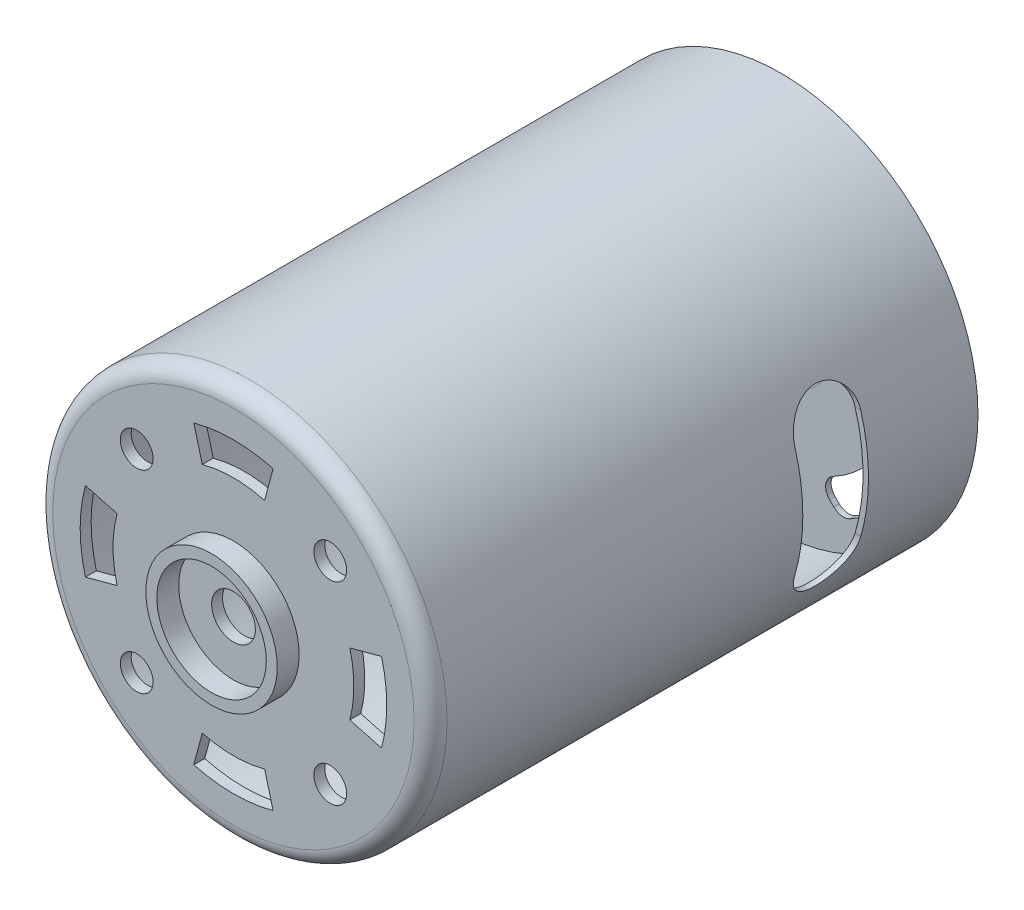
from build123d import *

# Parameters (mm, degrees)
CROQUIS1_R              = 18
CROQUIS1_R_2            = 17.5
SALIENTE_EXTRUIR1_DEPTH = 50
SALIENTE_EXTRUIR2_START = -1
CROQUIS2_R              = 17.5
SALIENTE_EXTRUIR2_DEPTH = 1
CORTAR_EXTRUIR1_DEPTH   = 19
REDONDEO1_R             = 1.5
SKETCH1_R               = 2
CUT_EXTRUDE1_DEPTH      = 10
CUT_EXTRUDE2_DEPTH      = 10
CUT_EXTRUDE3_DEPTH      = 0.5
BOSS_EXTRUDE1_DEPTH     = 0.5
BOSS_EXTRUDE1_2_DEPTH   = 0.5
BOSS_EXTRUDE1_3_DEPTH   = 0.5
BOSS_EXTRUDE1_4_DEPTH   = 0.5
BOSS_EXTRUDE1_5_DEPTH   = 0.5
BOSS_EXTRUDE1_6_DEPTH   = 0.5
BOSS_EXTRUDE5_DEPTH     = 0.1
BOSS_EXTRUDE5_2_DEPTH   = 0.1
BOSS_EXTRUDE5_3_DEPTH   = 0.1
BOSS_EXTRUDE5_4_DEPTH   = 0.1
BOSS_EXTRUDE5_5_DEPTH   = 0.1
BOSS_EXTRUDE5_6_DEPTH   = 0.1
SKETCH8_W               = 1.5
SKETCH8_H               = 4
CUT_EXTRUDE4_DEPTH      = 10
SKETCH9_R               = 1.5
CUT_EXTRUDE5_DEPTH      = 10
SKETCH10_R              = 6
SKETCH10_R_2            = 5
BOSS_EXTRUDE6_DEPTH     = 2


with BuildPart() as part:
    # Croquis1 → Saliente-Extruir1 (new body)
    with BuildSketch(Plane.XY):
        Circle(CROQUIS1_R)
        Circle(CROQUIS1_R_2, mode=Mode.SUBTRACT)
    extrude(amount=SALIENTE_EXTRUIR1_DEPTH)

    # Croquis2 → Saliente-Extruir2 (add)
    with BuildSketch(Plane.XY.offset(50).offset(SALIENTE_EXTRUIR2_START)):
        Circle(CROQUIS2_R)
    extrude(amount=SALIENTE_EXTRUIR2_DEPTH)

    # Croquis5 → Cortar-Extruir1 (cut, symmetric)
    with BuildSketch(Plane(origin=(0, 0, 0), x_dir=(0, 0, -1), z_dir=(1, 0, 0))):
        with BuildLine():
            Line((-10, 5), (-10, -5))
            ThreePointArc((-10, -5), (-13, -8), (-16, -5))
            Line((-16, -5), (-16, 5))
            ThreePointArc((-16, 5), (-13, 8), (-10, 5))
        make_face()
    extrude(amount=CORTAR_EXTRUIR1_DEPTH, both=True, mode=Mode.SUBTRACT)

    # Redondeo1
    redondeo1_edges = [part.edges().sort_by_distance(p)[0] for p in [
        (-17.5, 0, 49),
        (-18, 0, 50),
    ]]
    fillet(redondeo1_edges, radius=REDONDEO1_R)

    # Sketch1 → Cut-Extrude1 (cut)
    with BuildSketch(Plane.XY.offset(50)):
        Circle(SKETCH1_R)
    extrude(amount=-CUT_EXTRUDE1_DEPTH, mode=Mode.SUBTRACT)

    # Sketch2 → Revolve1 (revolve)
    with BuildSketch(Plane(origin=(0, 0, 0), x_dir=(0, 0, -1), z_dir=(1, 0, 0)), mode=Mode.PRIVATE) as revolve1_sk:
        with BuildLine():
            Line((-0.5, -2), (-0.5, -3.930100413))
            ThreePointArc((-0.5, -3.930100413), (-0.541526972, -4.335542637), (-0.664383398, -4.724148074))
            Line((-0.664383398, -4.724148074), (-0.835616602, -5.119991459))
            ThreePointArc((-0.835616602, -5.119991459), (-0.958473028, -5.508596895), (-1, -5.91403912))
            Line((-1, -5.91403912), (-1, -17.5))
            Line((-1, -17.5), (-0.5, -17.5))
            Line((-0.5, -17.5), (-0.5, -6.01755184))
            ThreePointArc((-0.5, -6.01755184), (-0.458473326, -5.612108115), (-0.335616602, -5.223501239))
            Line((-0.335616602, -5.223501239), (-0.164383398, -4.827657854))
            ThreePointArc((-0.164383398, -4.827657854), (-0.041526729, -4.439051245), (0, -4.033607798))
            Line((0, -4.033607798), (0, -2))
            Line((0, -2), (-0.5, -2))
        make_face()
    revolve(revolve1_sk.sketch.rotate(Axis((0, 0, 0), (0, 0, 1)), 270), axis=Axis((0, 0, 0), (0, 0, 1)))

    # Sketch3 → Cut-Extrude2 (cut)
    with BuildSketch(Plane(origin=(0, 0, 0.5), x_dir=(-1, 0, 0), z_dir=(0, 0, -1))):
        with BuildLine():
            Line((-12.521634284, 5.450566472), (-12.889677373, 5.818609561))
            ThreePointArc((-12.889677373, 5.818609561), (-13.243890781, 6.530399735), (-13.097229705, 7.311810586))
            ThreePointArc((-13.097229705, 7.311810586), (-10.606601718, 10.606601718), (-7.311810586, 13.097229705))
            ThreePointArc((-7.311810586, 13.097229705), (-6.530399735, 13.243890781), (-5.818609561, 12.889677373))
            Line((-5.818609561, 12.889677373), (-5.450566472, 12.521634284))
            ThreePointArc((-5.450566472, 12.521634284), (-5.097292691, 11.45902778), (-5.736860331, 10.539849788))
            ThreePointArc((-5.736860331, 10.539849788), (-8.485281374, 8.485281374), (-10.539849788, 5.736860331))
            ThreePointArc((-10.539849788, 5.736860331), (-11.45902778, 5.097292691), (-12.521634284, 5.450566472))
        make_face()
        with BuildLine():
            Line((-5.450566472, -12.521634284), (-5.818609561, -12.889677373))
            ThreePointArc((-5.818609561, -12.889677373), (-6.530399735, -13.243890781), (-7.311810586, -13.097229705))
            ThreePointArc((-7.311810586, -13.097229705), (-10.606601718, -10.606601718), (-13.097229705, -7.311810586))
            ThreePointArc((-13.097229705, -7.311810586), (-13.243890781, -6.530399735), (-12.889677373, -5.818609561))
            Line((-12.889677373, -5.818609561), (-12.521634284, -5.450566472))
            ThreePointArc((-12.521634284, -5.450566472), (-11.45902778, -5.097292691), (-10.539849788, -5.736860331))
            ThreePointArc((-10.539849788, -5.736860331), (-8.485281374, -8.485281374), (-5.736860331, -10.539849788))
            ThreePointArc((-5.736860331, -10.539849788), (-5.097292691, -11.45902778), (-5.450566472, -12.521634284))
        make_face()
        with BuildLine():
            Line((5.450566472, 12.521634284), (5.818609561, 12.889677373))
            ThreePointArc((5.818609561, 12.889677373), (6.530399735, 13.243890781), (7.311810586, 13.097229705))
            ThreePointArc((7.311810586, 13.097229705), (10.606601718, 10.606601718), (13.097229705, 7.311810586))
            ThreePointArc((13.097229705, 7.311810586), (13.243890781, 6.530399735), (12.889677373, 5.818609561))
            Line((12.889677373, 5.818609561), (12.521634284, 5.450566472))
            ThreePointArc((12.521634284, 5.450566472), (11.45902778, 5.097292691), (10.539849788, 5.736860331))
            ThreePointArc((10.539849788, 5.736860331), (8.485281374, 8.485281374), (5.736860331, 10.539849788))
            ThreePointArc((5.736860331, 10.539849788), (5.097292691, 11.45902778), (5.450566472, 12.521634284))
        make_face()
        with BuildLine():
            Line((12.521634284, -5.450566472), (12.889677373, -5.818609561))
            ThreePointArc((12.889677373, -5.818609561), (13.243890781, -6.530399735), (13.097229705, -7.311810586))
            ThreePointArc((13.097229705, -7.311810586), (10.606601718, -10.606601718), (7.311810586, -13.097229705))
            ThreePointArc((7.311810586, -13.097229705), (6.530399735, -13.243890781), (5.818609561, -12.889677373))
            Line((5.818609561, -12.889677373), (5.450566472, -12.521634284))
            ThreePointArc((5.450566472, -12.521634284), (5.097292691, -11.45902778), (5.736860331, -10.539849788))
            ThreePointArc((5.736860331, -10.539849788), (8.485281374, -8.485281374), (10.539849788, -5.736860331))
            ThreePointArc((10.539849788, -5.736860331), (11.45902778, -5.097292691), (12.521634284, -5.450566472))
        make_face()
    extrude(amount=-CUT_EXTRUDE2_DEPTH, mode=Mode.SUBTRACT)

    # Sketch4 → Cut-Extrude3 (cut)
    with BuildSketch(Plane(origin=(0, 0, 0), x_dir=(-1, 0, 0), z_dir=(0, 0, -1))):
        with BuildLine():
            Line((1.5, -17.435595774), (1.5, -17.686506156))
            ThreePointArc((1.5, -17.686506156), (0, -17.75), (-1.5, -17.686506156))
            Line((-1.5, -17.686506156), (-1.5, -17.435595774))
            ThreePointArc((-1.5, -17.435595774), (0, -17.5), (1.5, -17.435595774))
        make_face()
        with BuildLine():
            Line((-14.349668871, -10.016835993), (-14.566963635, -10.142291184))
            ThreePointArc((-14.566963635, -10.142291184), (-15.371950917, -8.875), (-16.066963635, -7.544214972))
            Line((-16.066963635, -7.544214972), (-15.849668871, -7.418759781))
            ThreePointArc((-15.849668871, -7.418759781), (-15.155444566, -8.75), (-14.349668871, -10.016835993))
        make_face()
        with BuildLine():
            Line((-15.849668871, 7.418759781), (-16.066963635, 7.544214972))
            ThreePointArc((-16.066963635, 7.544214972), (-15.371950917, 8.875), (-14.566963635, 10.142291184))
            Line((-14.566963635, 10.142291184), (-14.349668871, 10.016835993))
            ThreePointArc((-14.349668871, 10.016835993), (-15.155444566, 8.75), (-15.849668871, 7.418759781))
        make_face()
        with BuildLine():
            Line((-1.5, 17.435595774), (-1.5, 17.686506156))
            ThreePointArc((-1.5, 17.686506156), (0, 17.75), (1.5, 17.686506156))
            Line((1.5, 17.686506156), (1.5, 17.435595774))
            ThreePointArc((1.5, 17.435595774), (0, 17.5), (-1.5, 17.435595774))
        make_face()
        with BuildLine():
            Line((14.349668871, 10.016835993), (14.566963635, 10.142291184))
            ThreePointArc((14.566963635, 10.142291184), (15.371950917, 8.875), (16.066963635, 7.544214972))
            Line((16.066963635, 7.544214972), (15.849668871, 7.418759781))
            ThreePointArc((15.849668871, 7.418759781), (15.155444566, 8.75), (14.349668871, 10.016835993))
        make_face()
        with BuildLine():
            Line((15.849668871, -7.418759781), (16.066963635, -7.544214972))
            ThreePointArc((16.066963635, -7.544214972), (15.371950917, -8.875), (14.566963635, -10.142291184))
            Line((14.566963635, -10.142291184), (14.349668871, -10.016835993))
            ThreePointArc((14.349668871, -10.016835993), (15.155444566, -8.75), (15.849668871, -7.418759781))
        make_face()
    extrude(amount=-CUT_EXTRUDE3_DEPTH, mode=Mode.SUBTRACT)

    # Sketch8 → Cut-Extrude4 (cut)
    with BuildSketch(Plane(origin=(0, 0, 0.5), x_dir=(-1, 0, 0), z_dir=(0, 0, -1))):
        with Locations((-12, 0)):
            Rectangle(SKETCH8_W, SKETCH8_H)
        with Locations((12, 0)):
            Rectangle(SKETCH8_W, SKETCH8_H)
    extrude(amount=-CUT_EXTRUDE4_DEPTH, mode=Mode.SUBTRACT)

    # Sketch9 → Cut-Extrude5 (cut)
    with BuildSketch(Plane.XY.offset(50)):
        with Locations((8.838834765, 8.838834765)):
            Circle(SKETCH9_R)
        with Locations((8.838834765, -8.838834765)):
            Circle(SKETCH9_R)
        with Locations((-8.838834765, -8.838834765)):
            Circle(SKETCH9_R)
        with Locations((-8.838834765, 8.838834765)):
            Circle(SKETCH9_R)
        with BuildLine():
            Line((-2.847009496, 10.625184089), (-3.623466631, 13.522961568))
            ThreePointArc((-3.623466631, 13.522961568), (0, 14), (3.623466631, 13.522961568))
            Line((3.623466631, 13.522961568), (2.847009496, 10.625184089))
            ThreePointArc((2.847009496, 10.625184089), (0, 11), (-2.847009496, 10.625184089))
        make_face()
        with BuildLine():
            Line((10.625184089, 2.847009496), (13.522961568, 3.623466631))
            ThreePointArc((13.522961568, 3.623466631), (14, 0), (13.522961568, -3.623466631))
            Line((13.522961568, -3.623466631), (10.625184089, -2.847009496))
            ThreePointArc((10.625184089, -2.847009496), (11, 0), (10.625184089, 2.847009496))
        make_face()
        with BuildLine():
            Line((2.847009496, -10.625184089), (3.623466631, -13.522961568))
            ThreePointArc((3.623466631, -13.522961568), (0, -14), (-3.623466631, -13.522961568))
            Line((-3.623466631, -13.522961568), (-2.847009496, -10.625184089))
            ThreePointArc((-2.847009496, -10.625184089), (0, -11), (2.847009496, -10.625184089))
        make_face()
        with BuildLine():
            Line((-10.625184089, -2.847009496), (-13.522961568, -3.623466631))
            ThreePointArc((-13.522961568, -3.623466631), (-14, 0), (-13.522961568, 3.623466631))
            Line((-13.522961568, 3.623466631), (-10.625184089, 2.847009496))
            ThreePointArc((-10.625184089, 2.847009496), (-11, 0), (-10.625184089, -2.847009496))
        make_face()
    extrude(amount=-CUT_EXTRUDE5_DEPTH, mode=Mode.SUBTRACT)

    # Sketch10 → Boss-Extrude6 (add)
    with BuildSketch(Plane.XY.offset(50)):
        Circle(SKETCH10_R)
        Circle(SKETCH10_R_2, mode=Mode.SUBTRACT)
    extrude(amount=BOSS_EXTRUDE6_DEPTH)


with BuildPart() as body_2:
    # Sketch5 → Boss-Extrude1 (new body)
    with BuildSketch(Plane(origin=(0, 0, 0.5), x_dir=(-1, 0, 0), z_dir=(0, 0, -1))):
        with BuildLine():
            Line((1.5, -17.686506156), (1.5, -17.435595774))
            ThreePointArc((1.5, -17.435595774), (0, -17.5), (-1.5, -17.435595774))
            Line((-1.5, -17.435595774), (-1.5, -17.686506156))
            ThreePointArc((-1.5, -17.686506156), (0, -17.75), (1.5, -17.686506156))
        make_face()
    extrude(amount=BOSS_EXTRUDE1_DEPTH)


with BuildPart() as body_3:
    # Sketch5 → Boss-Extrude1 2 (new body)
    with BuildSketch(Plane(origin=(0, 0, 0.5), x_dir=(-1, 0, 0), z_dir=(0, 0, -1))):
        with BuildLine():
            Line((-14.566963635, -10.142291184), (-14.349668871, -10.016835993))
            ThreePointArc((-14.349668871, -10.016835993), (-15.155444566, -8.75), (-15.849668871, -7.418759781))
            Line((-15.849668871, -7.418759781), (-16.066963635, -7.544214972))
            ThreePointArc((-16.066963635, -7.544214972), (-15.371950917, -8.875), (-14.566963635, -10.142291184))
        make_face()
    extrude(amount=BOSS_EXTRUDE1_2_DEPTH)


with BuildPart() as body_4:
    # Sketch5 → Boss-Extrude1 3 (new body)
    with BuildSketch(Plane(origin=(0, 0, 0.5), x_dir=(-1, 0, 0), z_dir=(0, 0, -1))):
        with BuildLine():
            Line((-16.066963635, 7.544214972), (-15.849668871, 7.418759781))
            ThreePointArc((-15.849668871, 7.418759781), (-15.155444566, 8.75), (-14.349668871, 10.016835993))
            Line((-14.349668871, 10.016835993), (-14.566963635, 10.142291184))
            ThreePointArc((-14.566963635, 10.142291184), (-15.371950917, 8.875), (-16.066963635, 7.544214972))
        make_face()
    extrude(amount=BOSS_EXTRUDE1_3_DEPTH)


with BuildPart() as body_5:
    # Sketch5 → Boss-Extrude1 4 (new body)
    with BuildSketch(Plane(origin=(0, 0, 0.5), x_dir=(-1, 0, 0), z_dir=(0, 0, -1))):
        with BuildLine():
            Line((-1.5, 17.686506156), (-1.5, 17.435595774))
            ThreePointArc((-1.5, 17.435595774), (0, 17.5), (1.5, 17.435595774))
            Line((1.5, 17.435595774), (1.5, 17.686506156))
            ThreePointArc((1.5, 17.686506156), (0, 17.75), (-1.5, 17.686506156))
        make_face()
    extrude(amount=BOSS_EXTRUDE1_4_DEPTH)


with BuildPart() as body_6:
    # Sketch5 → Boss-Extrude1 5 (new body)
    with BuildSketch(Plane(origin=(0, 0, 0.5), x_dir=(-1, 0, 0), z_dir=(0, 0, -1))):
        with BuildLine():
            Line((14.566963635, 10.142291184), (14.349668871, 10.016835993))
            ThreePointArc((14.349668871, 10.016835993), (15.155444566, 8.75), (15.849668871, 7.418759781))
            Line((15.849668871, 7.418759781), (16.066963635, 7.544214972))
            ThreePointArc((16.066963635, 7.544214972), (15.371950917, 8.875), (14.566963635, 10.142291184))
        make_face()
    extrude(amount=BOSS_EXTRUDE1_5_DEPTH)


with BuildPart() as body_7:
    # Sketch5 → Boss-Extrude1 6 (new body)
    with BuildSketch(Plane(origin=(0, 0, 0.5), x_dir=(-1, 0, 0), z_dir=(0, 0, -1))):
        with BuildLine():
            Line((16.066963635, -7.544214972), (15.849668871, -7.418759781))
            ThreePointArc((15.849668871, -7.418759781), (15.155444566, -8.75), (14.349668871, -10.016835993))
            Line((14.349668871, -10.016835993), (14.566963635, -10.142291184))
            ThreePointArc((14.566963635, -10.142291184), (15.371950917, -8.875), (16.066963635, -7.544214972))
        make_face()
    extrude(amount=BOSS_EXTRUDE1_6_DEPTH)


with BuildPart() as body_8:
    # Sketch7 → Boss-Extrude5 (new body)
    with BuildSketch(Plane(origin=(0, 0, 0.5), x_dir=(-1, 0, 0), z_dir=(0, 0, -1))):
        with BuildLine():
            Line((-1.5, -17.435595774), (-1.5, -16.685595774))
            ThreePointArc((-1.5, -16.685595774), (0, -15.400403363), (1.5, -16.685595774))
            Line((1.5, -16.685595774), (1.5, -17.435595774))
            ThreePointArc((1.5, -17.435595774), (0, -17.5), (-1.5, -17.435595774))
        make_face()
    extrude(amount=BOSS_EXTRUDE5_DEPTH)


with BuildPart() as body_9:
    # Sketch7 → Boss-Extrude5 2 (new body)
    with BuildSketch(Plane(origin=(0, 0, 0.5), x_dir=(-1, 0, 0), z_dir=(0, 0, -1))):
        with BuildLine():
            Line((-15.849668871, -7.418759781), (-15.200149818, -7.043759781))
            ThreePointArc((-15.200149818, -7.043759781), (-13.337140541, -7.700201681), (-13.700149818, -9.641835993))
            Line((-13.700149818, -9.641835993), (-14.349668871, -10.016835993))
            ThreePointArc((-14.349668871, -10.016835993), (-15.155444566, -8.75), (-15.849668871, -7.418759781))
        make_face()
    extrude(amount=BOSS_EXTRUDE5_2_DEPTH)


with BuildPart() as body_10:
    # Sketch7 → Boss-Extrude5 3 (new body)
    with BuildSketch(Plane(origin=(0, 0, 0.5), x_dir=(-1, 0, 0), z_dir=(0, 0, -1))):
        with BuildLine():
            Line((-14.349668871, 10.016835993), (-13.700149818, 9.641835993))
            ThreePointArc((-13.700149818, 9.641835993), (-13.337140541, 7.700201681), (-15.200149818, 7.043759781))
            Line((-15.200149818, 7.043759781), (-15.849668871, 7.418759781))
            ThreePointArc((-15.849668871, 7.418759781), (-15.155444566, 8.75), (-14.349668871, 10.016835993))
        make_face()
    extrude(amount=BOSS_EXTRUDE5_3_DEPTH)


with BuildPart() as body_11:
    # Sketch7 → Boss-Extrude5 4 (new body)
    with BuildSketch(Plane(origin=(0, 0, 0.5), x_dir=(-1, 0, 0), z_dir=(0, 0, -1))):
        with BuildLine():
            Line((1.5, 17.435595774), (1.5, 16.685595774))
            ThreePointArc((1.5, 16.685595774), (0, 15.400403363), (-1.5, 16.685595774))
            Line((-1.5, 16.685595774), (-1.5, 17.435595774))
            ThreePointArc((-1.5, 17.435595774), (0, 17.5), (1.5, 17.435595774))
        make_face()
    extrude(amount=BOSS_EXTRUDE5_4_DEPTH)


with BuildPart() as body_12:
    # Sketch7 → Boss-Extrude5 5 (new body)
    with BuildSketch(Plane(origin=(0, 0, 0.5), x_dir=(-1, 0, 0), z_dir=(0, 0, -1))):
        with BuildLine():
            Line((15.849668871, 7.418759781), (15.200149818, 7.043759781))
            ThreePointArc((15.200149818, 7.043759781), (13.337140541, 7.700201681), (13.700149818, 9.641835993))
            Line((13.700149818, 9.641835993), (14.349668871, 10.016835993))
            ThreePointArc((14.349668871, 10.016835993), (15.155444566, 8.75), (15.849668871, 7.418759781))
        make_face()
    extrude(amount=BOSS_EXTRUDE5_5_DEPTH)


with BuildPart() as body_13:
    # Sketch7 → Boss-Extrude5 6 (new body)
    with BuildSketch(Plane(origin=(0, 0, 0.5), x_dir=(-1, 0, 0), z_dir=(0, 0, -1))):
        with BuildLine():
            Line((14.349668871, -10.016835993), (13.700149818, -9.641835993))
            ThreePointArc((13.700149818, -9.641835993), (13.337140541, -7.700201681), (15.200149818, -7.043759781))
            Line((15.200149818, -7.043759781), (15.849668871, -7.418759781))
            ThreePointArc((15.849668871, -7.418759781), (15.155444566, -8.75), (14.349668871, -10.016835993))
        make_face()
    extrude(amount=BOSS_EXTRUDE5_6_DEPTH)


solid = Compound([part.part, body_2.part, body_3.part, body_4.part, body_5.part, body_6.part, body_7.part, body_8.part, body_9.part, body_10.part, body_11.part, body_12.part, body_13.part])
